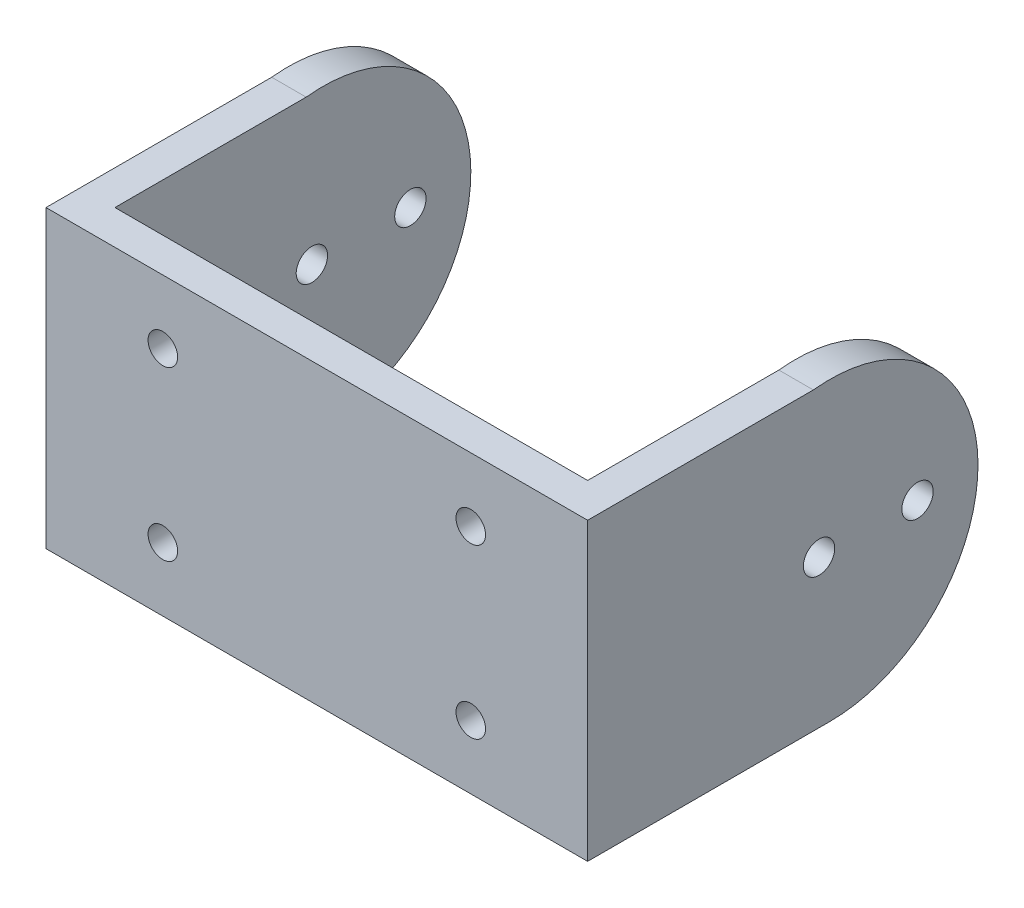
from build123d import *

# Parameters (mm, degrees)
SKETCH_1_W      = 55
SKETCH_1_H      = 30
SKETCH_1_R      = 1.5
EXTRUDE_1_DEPTH = 3.5
SKETCH_2_R      = 1.592723526
EXTRUDE_2_DEPTH = 3.5


with BuildPart() as part:
    # 草图1 → 凸台-拉伸1 (new body)
    with BuildSketch(Plane.XY):
        Rectangle(SKETCH_1_W, SKETCH_1_H)
        with Locations((15.634746474, 8.528043531)):
            Circle(SKETCH_1_R, mode=Mode.SUBTRACT)
        with Locations(Location((-15.634746474, 8.528043531, 0), (0, 0, 180))):
            Circle(SKETCH_1_R, mode=Mode.SUBTRACT)
        with Locations(Location((15.634746474, -8.528043531, 0), (0, 0, 180))):
            Circle(SKETCH_1_R, mode=Mode.SUBTRACT)
        with Locations((-15.634746474, -8.528043531)):
            Circle(SKETCH_1_R, mode=Mode.SUBTRACT)
    extrude(amount=EXTRUDE_1_DEPTH)

    # 草图2 → 凸台-拉伸2 (add)
    with BuildSketch(Plane(origin=(27.5, 0, 0), x_dir=(0, 0, -1), z_dir=(1, 0, 0))):
        with BuildLine():
            Line((0, 15), (0, -15))
            Line((0, -15), (21, -15))
            ThreePointArc((21, -15), (36.119015722, 0.838004237), (19.419767517, 15))
            Line((19.419767517, 15), (0, 15))
        make_face()
        with Locations((20, 0)):
            Circle(SKETCH_2_R, mode=Mode.SUBTRACT)
        with Locations(Location((30, 0, 0), (0, 0, 180))):
            Circle(SKETCH_2_R, mode=Mode.SUBTRACT)
    extrude_2 = extrude(amount=-EXTRUDE_2_DEPTH)

    # 镜向1: 凸台-拉伸2 across plane
    add(extrude_2.mirror(Plane(origin=(0, 0, 0), x_dir=(0, 0, 1), z_dir=(1, 0, 0))))


solid = part.part
